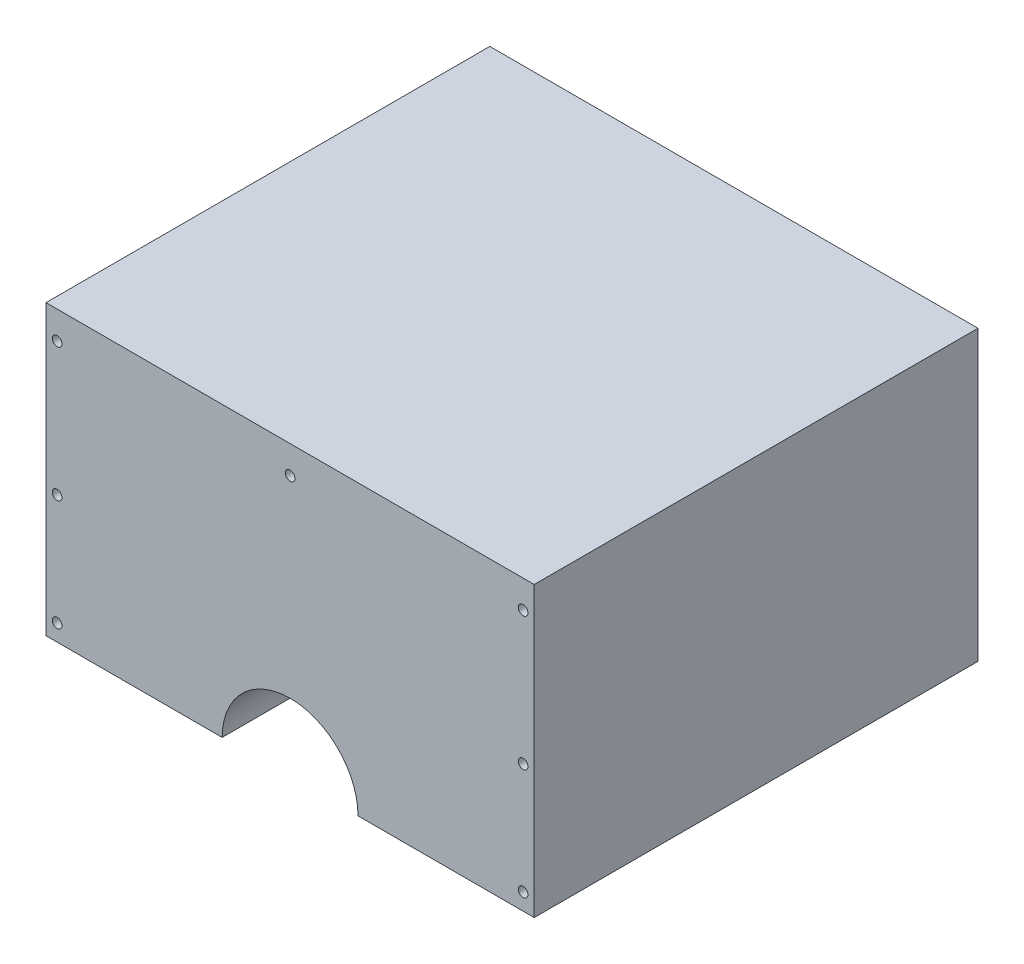
from build123d import *

# Parameters (mm, degrees)
SKETCH1_W           = 279.4
SKETCH1_H           = 165.1
BOSS_EXTRUDE1_DEPTH = 254
SKETCH2_R           = 38.8874
CUT_EXTRUDE1_DEPTH  = 413.114510786
SKETCH3_R           = 2.7686
CUT_EXTRUDE2_DEPTH  = 413.114510786


with BuildPart() as part:
    # Sketch1 → Boss-Extrude1 (new body)
    with BuildSketch(Plane.XY):
        with Locations((139.7, 82.55)):
            Rectangle(SKETCH1_W, SKETCH1_H)
    extrude(amount=BOSS_EXTRUDE1_DEPTH)

    # Sketch2 → Cut-Extrude1 (cut, through all)
    with BuildSketch(Plane.XY):
        with Locations((139.7, 0)):
            Circle(SKETCH2_R)
    extrude(amount=CUT_EXTRUDE1_DEPTH, mode=Mode.SUBTRACT)

    # Sketch3 → Cut-Extrude2 (cut, through all)
    with BuildSketch(Plane.XY):
        with Locations((6.35, 149.225)):
            Circle(SKETCH3_R)
        with Locations((139.7, 149.225)):
            Circle(SKETCH3_R)
        with Locations((273.05, 149.225)):
            Circle(SKETCH3_R)
        with Locations((6.35, 73.025)):
            Circle(SKETCH3_R)
        with Locations((273.05, 73.025)):
            Circle(SKETCH3_R)
        with Locations((6.35, 9.525)):
            Circle(SKETCH3_R)
        with Locations((273.05, 9.525)):
            Circle(SKETCH3_R)
    extrude(amount=CUT_EXTRUDE2_DEPTH, mode=Mode.SUBTRACT)


solid = part.part
